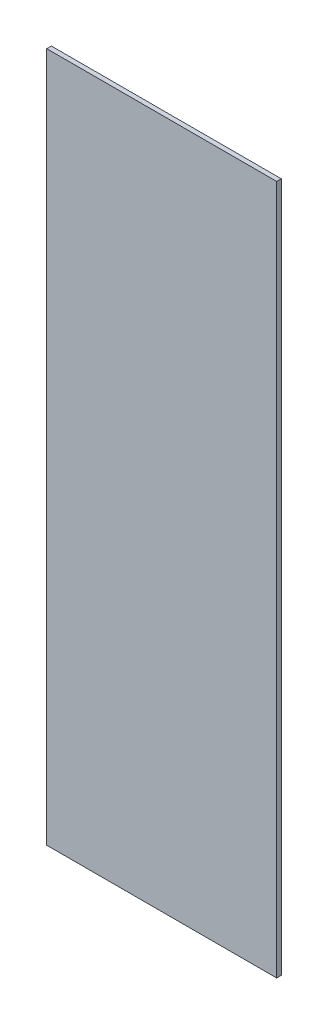
from build123d import *

# Parameters (mm, degrees)
SKETCH1_W           = 100
SKETCH1_H           = 300
BOSS_EXTRUDE1_DEPTH = 2


with BuildPart() as part:
    # Sketch1 → Boss-Extrude1 (new body)
    with BuildSketch(Plane.XY):
        Rectangle(SKETCH1_W, SKETCH1_H)
    extrude(amount=BOSS_EXTRUDE1_DEPTH)


solid = part.part
